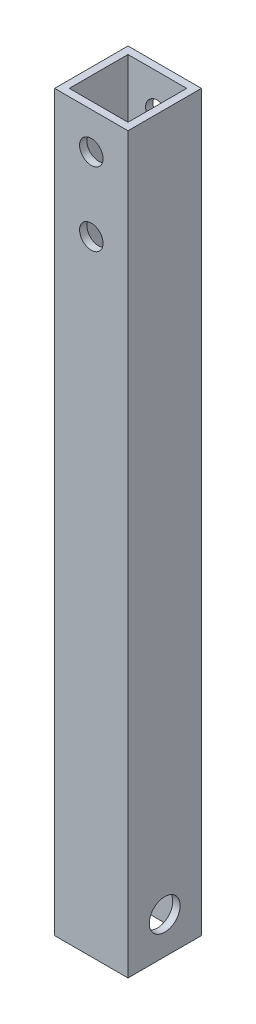
from build123d import *

# Parameters (mm, degrees)
SKETCH_1_W          = 10
SKETCH_1_H          = 10
SKETCH_1_W_2        = 8
SKETCH_1_H_2        = 8
EXTRUDE_1_DEPTH     = 100
SKETCH_2_R          = 2.1
CUT_EXTRUDE_1_DEPTH = 101.623058987
SKETCH_3_R          = 1.6
CUT_EXTRUDE_2_DEPTH = 101.623058987


with BuildPart() as part:
    # ｽｹｯﾁ1 → 押し出し-薄板1 (new body)
    with BuildSketch(Plane(origin=(0, 0, 0), x_dir=(1, 0, 0), z_dir=(0, 1, 0))):
        Rectangle(SKETCH_1_W, SKETCH_1_H)
        Rectangle(SKETCH_1_W_2, SKETCH_1_H_2, mode=Mode.SUBTRACT)
    extrude(amount=EXTRUDE_1_DEPTH)

    # ｽｹｯﾁ2 → ｶｯﾄ - 押し出し1 (cut, through all)
    with BuildSketch(Plane(origin=(5, 0, 0), x_dir=(0, 0, -1), z_dir=(1, 0, 0))):
        with Locations((0, 5)):
            Circle(SKETCH_2_R)
    extrude(amount=-CUT_EXTRUDE_1_DEPTH, mode=Mode.SUBTRACT)

    # ｽｹｯﾁ3 → ｶｯﾄ - 押し出し2 (cut, through all)
    with BuildSketch(Plane.XY.offset(5)):
        with Locations((0, 85)):
            Circle(SKETCH_3_R)
        with Locations((0, 95)):
            Circle(SKETCH_3_R)
    extrude(amount=-CUT_EXTRUDE_2_DEPTH, mode=Mode.SUBTRACT)


solid = part.part
